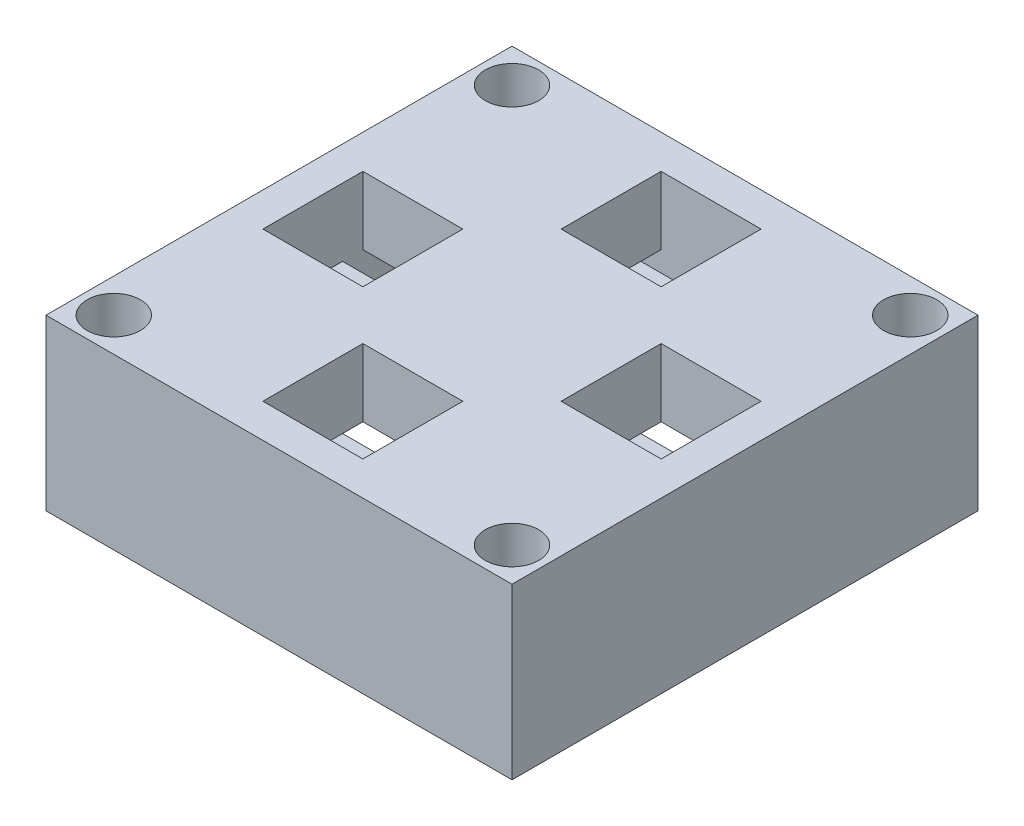
from build123d import *

# Parameters (mm, degrees)
SKETCH1_W           = 55
SKETCH1_H           = 55
SKETCH1_W_2         = 11.8
SKETCH1_H_2         = 11.8
BOSS_EXTRUDE1_DEPTH = 8
SKETCH2_W           = 55
SKETCH2_H           = 55
BOSS_EXTRUDE7_DEPTH = 12
SKETCH2_5_W         = 23.6
SKETCH2_5_H         = 7
SKETCH2_5_W_2       = 47
BOSS_EXTRUDE8_DEPTH = 8
SKETCH6_R           = 3.15
CUT_EXTRUDE1_DEPTH  = 44.732139211


with BuildPart() as part:
    # Sketch1 → Boss-Extrude1 (new body)
    with BuildSketch(Plane(origin=(0, 0, 0), x_dir=(1, 0, 0), z_dir=(0, 1, 0))):
        Rectangle(SKETCH1_W, SKETCH1_H)
        with Locations((0, 17.6)):
            Rectangle(SKETCH1_W_2, SKETCH1_H_2, mode=Mode.SUBTRACT)
        with Locations((17.6, 0)):
            Rectangle(SKETCH1_W_2, SKETCH1_H_2, mode=Mode.SUBTRACT)
        with Locations((-17.6, 0)):
            Rectangle(SKETCH1_W_2, SKETCH1_H_2, mode=Mode.SUBTRACT)
        with Locations((0, -17.6)):
            Rectangle(SKETCH1_W_2, SKETCH1_H_2, mode=Mode.SUBTRACT)
    extrude(amount=BOSS_EXTRUDE1_DEPTH)

    # Sketch2 → Boss-Extrude7 (add)
    with BuildSketch(Plane.XZ):
        Rectangle(SKETCH2_W, SKETCH2_H)
        Polygon((-23.5, 23.5), (-5.9, 23.5), (5.9, 23.5), (23.5, 23.5), (23.5, 5.9), (23.5, 3.5), (23.5, -3.5), (23.5, -5.9), (23.5, -23.5), (5.9, -23.5), (-5.9, -23.5), (-23.5, -23.5), (-23.5, -5.9), (-23.5, -3.5), (-23.5, 3.5), (-23.5, 5.9), align=None, mode=Mode.SUBTRACT)
    extrude(amount=BOSS_EXTRUDE7_DEPTH)

    # Sketch2<5> → Boss-Extrude8 (add)
    with BuildSketch(Plane.XZ):
        with Locations((0, 17.6)):
            Rectangle(SKETCH2_5_W, SKETCH2_5_H)
        Rectangle(SKETCH2_5_W_2, SKETCH2_5_H)
        with Locations((0, -17.6)):
            Rectangle(SKETCH2_5_W, SKETCH2_5_H)
    extrude(amount=BOSS_EXTRUDE8_DEPTH)

    # Sketch6 → Cut-Extrude1 (cut, through all)
    with BuildSketch(Plane.XZ.offset(12)):
        with Locations((-23.5, 23.5)):
            Circle(SKETCH6_R)
        with Locations((23.5, 23.5)):
            Circle(SKETCH6_R)
        with Locations((-23.5, -23.5)):
            Circle(SKETCH6_R)
        with Locations((23.5, -23.5)):
            Circle(SKETCH6_R)
    extrude(amount=-CUT_EXTRUDE1_DEPTH, mode=Mode.SUBTRACT)


solid = part.part
